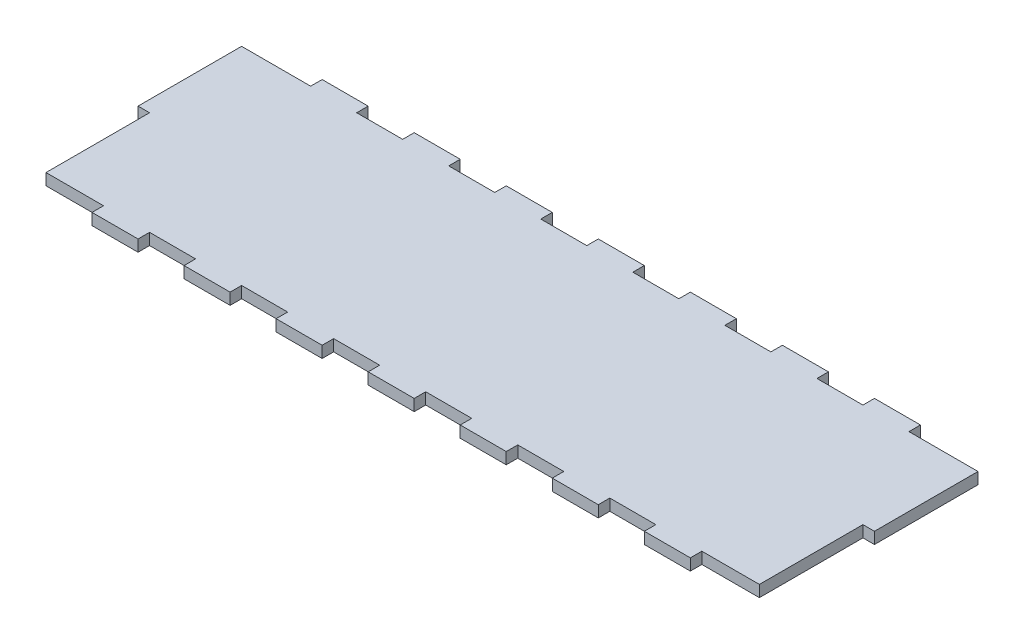
from build123d import *

# Parameters (mm, degrees)
SKETCH1_W           = 160
SKETCH1_H           = 50
BOSS_EXTRUDE1_DEPTH = 1.25
SKETCH2_W           = 10
SKETCH2_H           = 2.5
SKETCH2_W_2         = 15
CUT_EXTRUDE1_DEPTH  = 4
SKETCH3_W           = 2.5
SKETCH3_H           = 22.5
CUT_EXTRUDE2_DEPTH  = 84.852549156


with BuildPart() as part:
    # Sketch1 → Boss-Extrude1 (new, symmetric)
    with BuildSketch(Plane(origin=(0, 0, 0), x_dir=(1, 0, 0), z_dir=(0, 1, 0))):
        Rectangle(SKETCH1_W, SKETCH1_H)
    extrude(amount=BOSS_EXTRUDE1_DEPTH, both=True)

    # Sketch2 → Cut-Extrude1 (cut)
    with BuildSketch(Plane(origin=(0, 1.25, 0), x_dir=(1, 0, 0), z_dir=(0, 1, 0))):
        with Locations((30, 23.75)):
            Rectangle(SKETCH2_W, SKETCH2_H)
        with Locations((10, 23.75)):
            Rectangle(SKETCH2_W, SKETCH2_H)
        with Locations((10, -23.75)):
            Rectangle(SKETCH2_W, SKETCH2_H)
        with Locations((30, -23.75)):
            Rectangle(SKETCH2_W, SKETCH2_H)
        with Locations((50, 23.75)):
            Rectangle(SKETCH2_W, SKETCH2_H)
        with Locations((50, -23.75)):
            Rectangle(SKETCH2_W, SKETCH2_H)
        with Locations((-10, 23.75)):
            Rectangle(SKETCH2_W, SKETCH2_H)
        with Locations((-10, -23.75)):
            Rectangle(SKETCH2_W, SKETCH2_H)
        with Locations((-30, 23.75)):
            Rectangle(SKETCH2_W, SKETCH2_H)
        with Locations((-30, -23.75)):
            Rectangle(SKETCH2_W, SKETCH2_H)
        with Locations((-50, 23.75)):
            Rectangle(SKETCH2_W, SKETCH2_H)
        with Locations((-50, -23.75)):
            Rectangle(SKETCH2_W, SKETCH2_H)
        with Locations((72.5, 23.75)):
            Rectangle(SKETCH2_W_2, SKETCH2_H)
        with Locations((72.5, -23.75)):
            Rectangle(SKETCH2_W_2, SKETCH2_H)
        with Locations((-72.5, 23.75)):
            Rectangle(SKETCH2_W_2, SKETCH2_H)
        with Locations((-72.5, -23.75)):
            Rectangle(SKETCH2_W_2, SKETCH2_H)
    extrude(amount=-CUT_EXTRUDE1_DEPTH, mode=Mode.SUBTRACT)

    # Sketch3 → Cut-Extrude2 (cut, through all)
    with BuildSketch(Plane(origin=(0, 1.25, 0), x_dir=(1, 0, 0), z_dir=(0, 1, 0))):
        with Locations((78.75, -11.25)):
            Rectangle(SKETCH3_W, SKETCH3_H)
        with Locations((-78.75, -11.25)):
            Rectangle(SKETCH3_W, SKETCH3_H)
    extrude(amount=-CUT_EXTRUDE2_DEPTH, mode=Mode.SUBTRACT)


solid = part.part
